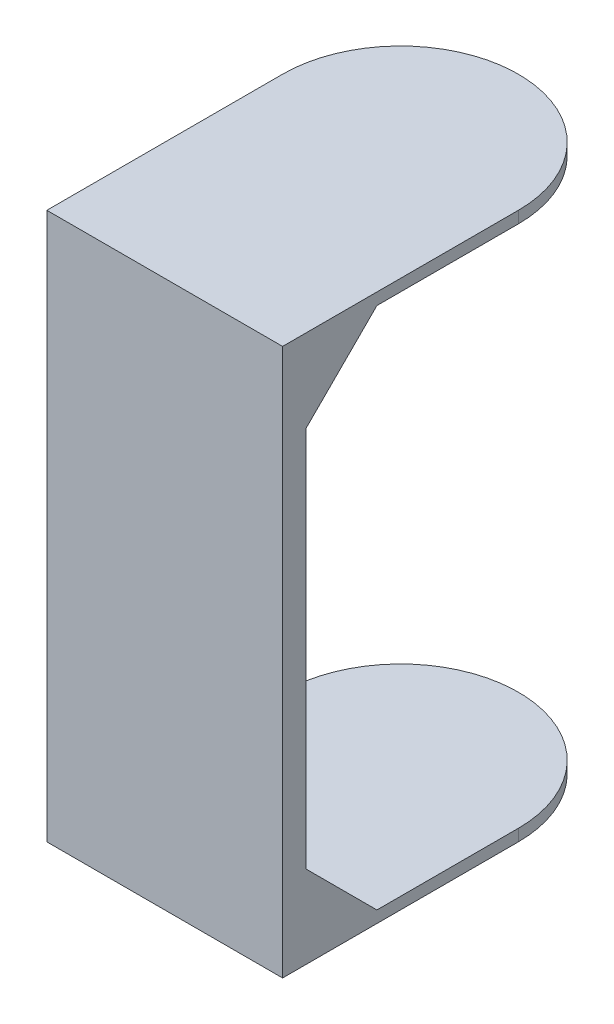
from build123d import *

# Parameters (mm, degrees)
PLATE_SKETCH_W                  = 100
PLATE_SKETCH_H                  = 222
PLATE_EXTRUDE_DEPTH             = 10
PRIMARY_SUPPORT_EXTRUDE_DEPTH   = 10
SECONDARY_SUPPORT_EXTRUDE_DEPTH = 10
GRIPPER_EXTRUDE_DEPTH           = 5


with BuildPart() as part:
    # Plate Sketch → Plate Extrude (new body)
    with BuildSketch(Plane.XY):
        Rectangle(PLATE_SKETCH_W, PLATE_SKETCH_H)
    extrude(amount=-PLATE_EXTRUDE_DEPTH)

    # Primary Support Sketch → Primary Support Extrude (add)
    with BuildSketch(Plane(origin=(50, 0, 0), x_dir=(0, 0, -1), z_dir=(1, 0, 0))):
        Polygon((10, 111), (10, 81), (40, 111), align=None)
    primary_support_extrude = extrude(amount=-PRIMARY_SUPPORT_EXTRUDE_DEPTH)

    # Primary Support Mirror: Primary Support Extrude across plane
    add(primary_support_extrude.mirror(Plane.ZX))

    # Secondary Support Sketch → Secondary Support Extrude (add)
    with BuildSketch(Plane.ZY.offset(50)):
        Polygon((-10, 81), (-40, 111), (-10, 111), align=None)
    extrude(amount=-SECONDARY_SUPPORT_EXTRUDE_DEPTH)

    # Gripper Sketch → Gripper Extrude (add)
    with BuildSketch(Plane(origin=(0, 111, 0), x_dir=(1, 0, 0), z_dir=(0, 1, 0))):
        with BuildLine():
            Line((-50, 0), (50, 0))
            Line((50, 0), (50, 100))
            ThreePointArc((50, 100), (0, 150), (-50, 100))
            Line((-50, 100), (-50, 0))
        make_face()
    gripper_extrude = extrude(amount=GRIPPER_EXTRUDE_DEPTH)

    # Gripper Mirror: Gripper Extrude across plane
    add(gripper_extrude.mirror(Plane.ZX))


solid = part.part
